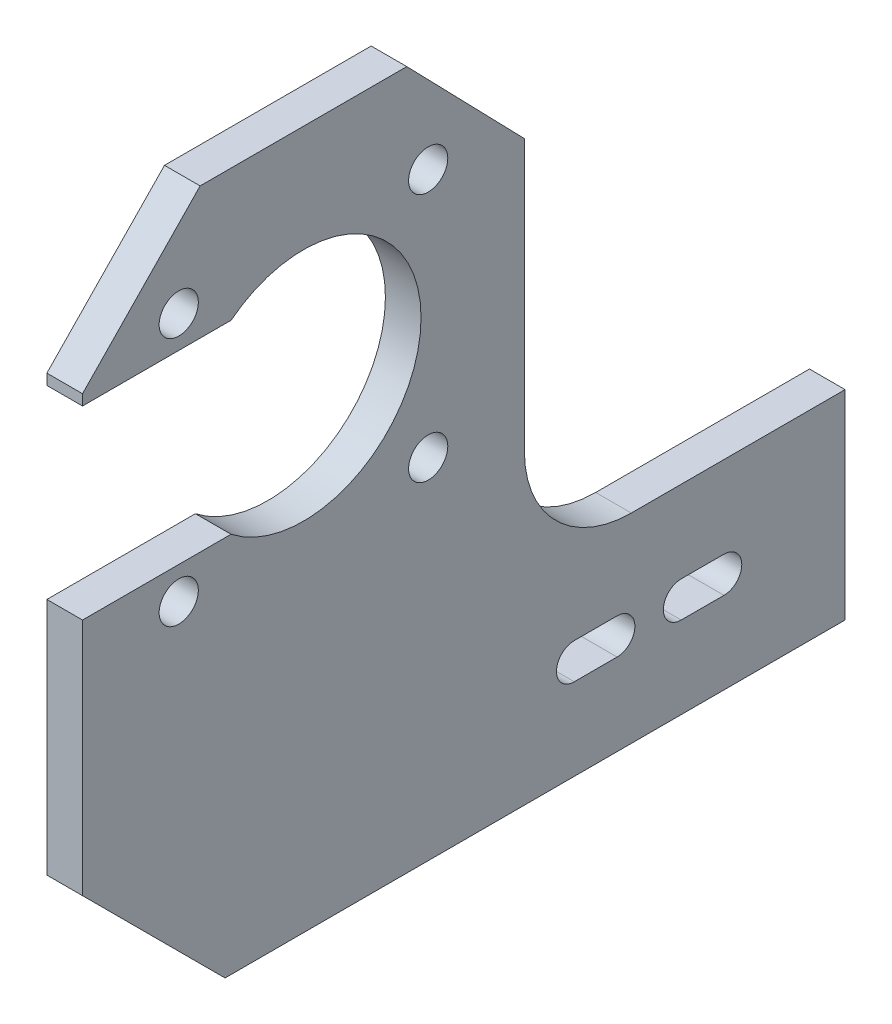
from build123d import *

# Parameters (mm, degrees)
ESBO_O2_R                      = 2.75
CORPO_DEPTH                    = 5
RAIO_DE_AL_VIO_DE_TENS_O_R15_R = 15
CHAMFER1_SIZE                  = 20


with BuildPart() as part:
    # Esboço2 → Corpo (new body)
    with BuildSketch(Plane(origin=(0, 0, 0), x_dir=(0, 0, -1), z_dir=(1, 0, 0))):
        with BuildLine():
            Line((0, 49), (16.5, 66))
            Line((16.5, 66), (45.5, 66))
            Line((45.5, 66), (62, 49))
            Line((62, 49), (62, 0))
            Line((62, 0), (62, -4))
            Line((62, -4), (107, -4))
            Line((107, -4), (107, -32))
            Line((107, -32), (0, -32))
            Line((0, -32), (0, 0))
            Line((0, 0), (0, 21.5))
            Line((0, 21.5), (20.838799284, 21.5))
            ThreePointArc((20.838799284, 21.5), (47.5, 34.5), (20.838799284, 47.5))
            Line((20.838799284, 47.5), (0, 47.5))
            Line((0, 47.5), (0, 49))
        make_face()
        with Locations((48.5, 52)):
            Circle(ESBO_O2_R, mode=Mode.SUBTRACT)
        with Locations((13.5, 52)):
            Circle(ESBO_O2_R, mode=Mode.SUBTRACT)
        with Locations((48.5, 17)):
            Circle(ESBO_O2_R, mode=Mode.SUBTRACT)
        with Locations((13.5, 17)):
            Circle(ESBO_O2_R, mode=Mode.SUBTRACT)
        with BuildLine():
            Line((69, -15.5), (75, -15.5))
            ThreePointArc((75, -15.5), (77.5, -18), (75, -20.5))
            Line((75, -20.5), (69, -20.5))
            ThreePointArc((69, -20.5), (66.5, -18), (69, -15.5))
        make_face(mode=Mode.SUBTRACT)
        with BuildLine():
            Line((84, -15.5), (90, -15.5))
            ThreePointArc((90, -15.5), (92.5, -18), (90, -20.5))
            Line((90, -20.5), (84, -20.5))
            ThreePointArc((84, -20.5), (81.5, -18), (84, -15.5))
        make_face(mode=Mode.SUBTRACT)
    extrude(amount=-CORPO_DEPTH)

    # Raio de Alívio de Tensão - R15
    raio_de_al_vio_de_tens_o_r15_edges = [part.edges().sort_by_distance(p)[0] for p in [
        (-2.5, -4, -62),
    ]]
    fillet(raio_de_al_vio_de_tens_o_r15_edges, radius=RAIO_DE_AL_VIO_DE_TENS_O_R15_R)

    # Chamfer1
    chamfer1_edges = [part.edges().sort_by_distance(p)[0] for p in [
        (-2.5, -32, 0),
    ]]
    chamfer(chamfer1_edges, length=CHAMFER1_SIZE)


solid = part.part
